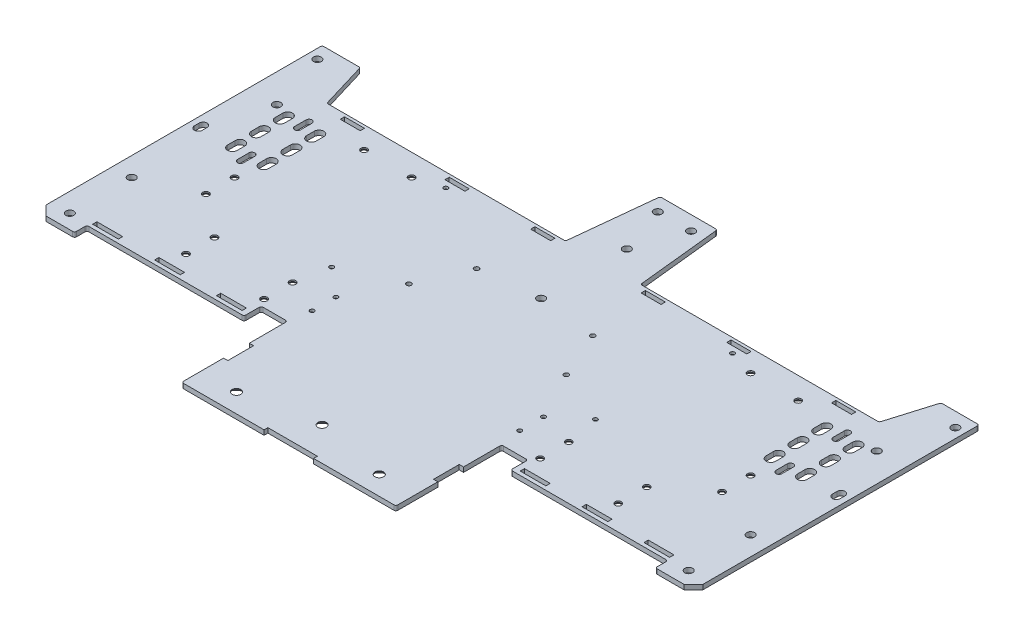
from build123d import *

# Parameters (mm, degrees)
EXTRUDE_1_DEPTH              = 5
EXTRUDE_2_DEPTH              = 5
SKETCH_22_W                  = 40
SKETCH_22_H                  = 13
EXTRUDE_3_DEPTH              = 5
CUT_EXTRUDE_1_DEPTH          = 45
CUT_EXTRUDE_4_DEPTH          = 70
SKETCH_23_W                  = 27.5
SKETCH_23_H                  = 18
CUT_EXTRUDE_6_DEPTH          = 10
SKETCH_27_W                  = 21
SKETCH_27_H                  = 4.5
CUT_EXTRUDE_7_DEPTH          = 478.441095843
SKETCH_38_W                  = 27
SKETCH_38_H                  = 4.5
SKETCH_38_W_2                = 4.5
SKETCH_38_H_2                = 27
SKETCH_38_W_3                = 52
SKETCH_38_H_3                = 4
CUT_EXTRUDE_8_DEPTH          = 478.441095843
HOLE_WIZARD_M61_AT_2_COUNT   = 2
HOLE_WIZARD_M61_AT_2_PITCH   = 50
HOLE_WIZARD_M61_AT_3_COUNT   = 2
HOLE_WIZARD_M61_AT_3_PITCH   = 406
HOLE_WIZARD_M61_AT_4_COUNT   = 2
HOLE_WIZARD_M61_AT_4_PITCH   = 456
HOLE_WIZARD_M41_D            = 4.5
HOLE_WIZARD_M41_CSINK_D      = 9.18
HOLE_WIZARD_M41_CSINK_ANGLE  = 90
HOLE_WIZARD_M82_D            = 8.25
HOLE_WIZARD_M82_2_AT_2_COUNT = 2
HOLE_WIZARD_M82_2_AT_2_PITCH = 150
HOLE_WIZARD_M82_2_AT_3_COUNT = 2
HOLE_WIZARD_M82_2_AT_3_PITCH = 76.485292704
HOLE_WIZARD_M62_D            = 6.6
HOLE_WIZARD_M62_DEPTH        = 17
HOLE_WIZARD_M62_CSINK_D      = 13.71
HOLE_WIZARD_M62_CSINK_ANGLE  = 90
HOLE_WIZARD_M62_TIP          = 1.982840043
HOLE_WIZARD_M42_D            = 4.5
HOLE_WIZARD_M42_CSINK_D      = 9.18
HOLE_WIZARD_M42_CSINK_ANGLE  = 90
CUT_EXTRUDE_10_DEPTH         = 478.441095843
CHAMFER_1_SIZE               = 10
FILLET_1_R                   = 2
SKETCH_46_R                  = 2.5
CUT_EXTRUDE_11_DEPTH         = 478.441095843


with BuildPart() as part:
    # Эскиз2 → Бобышка-Вытянуть1 (new body)
    with BuildSketch(Plane(origin=(0, 0, 0), x_dir=(1, 0, 0), z_dir=(0, 1, 0))):
        Polygon((112.5, -237), (112.5, -330), (-112.5, -330), (-112.5, -237), (-345, -237), (-345, 50), (-305, 50), (-290, 0), (290, 0), (305, 50), (345, 50), (345, -237), align=None)
    extrude(amount=EXTRUDE_1_DEPTH)

    # Эскиз21 → Бобышка-Вытянуть2 (add)
    with BuildSketch(Plane(origin=(0, 5, 0), x_dir=(1, 0, 0), z_dir=(0, 1, 0))):
        Polygon((-39.459381174, 0), (-30, 90), (30, 90), (39.459381174, 0), align=None)
    extrude(amount=-EXTRUDE_2_DEPTH)

    # Эскиз22 → Бобышка-Вытянуть3 (add)
    with BuildSketch(Plane(origin=(0, 5, 0), x_dir=(1, 0, 0), z_dir=(0, 1, 0))):
        with Locations((-325, -243.5)):
            Rectangle(SKETCH_22_W, SKETCH_22_H)
        with Locations((325, -243.5)):
            Rectangle(SKETCH_22_W, SKETCH_22_H)
    extrude(amount=-EXTRUDE_3_DEPTH)

    # Эскиз8 → Вырез-Вытянуть1 (cut)
    with BuildSketch(Plane(origin=(0, 5, 0), x_dir=(1, 0, 0), z_dir=(0, 1, 0))):
        with BuildLine():
            Line((-271.25, -40), (-271.25, -32))
            ThreePointArc((-271.25, -32), (-266.25, -27), (-261.25, -32))
            Line((-261.25, -32), (-261.25, -40))
            ThreePointArc((-261.25, -40), (-266.25, -45), (-271.25, -40))
        make_face()
        with BuildLine():
            Line((-271.25, -65), (-271.25, -57))
            ThreePointArc((-271.25, -57), (-266.25, -52), (-261.25, -57))
            Line((-261.25, -57), (-261.25, -65))
            ThreePointArc((-261.25, -65), (-266.25, -70), (-271.25, -65))
        make_face()
        with BuildLine():
            Line((-271.25, -90), (-271.25, -82))
            ThreePointArc((-271.25, -82), (-266.25, -77), (-261.25, -82))
            Line((-261.25, -82), (-261.25, -90))
            ThreePointArc((-261.25, -90), (-266.25, -95), (-271.25, -90))
        make_face()
        with BuildLine():
            Line((-304.25, -65), (-304.25, -57))
            ThreePointArc((-304.25, -57), (-299.25, -52), (-294.25, -57))
            Line((-294.25, -57), (-294.25, -65))
            ThreePointArc((-294.25, -65), (-299.25, -70), (-304.25, -65))
        make_face()
        with BuildLine():
            Line((-304.25, -40), (-304.25, -32))
            ThreePointArc((-304.25, -32), (-299.25, -27), (-294.25, -32))
            Line((-294.25, -32), (-294.25, -40))
            ThreePointArc((-294.25, -40), (-299.25, -45), (-304.25, -40))
        make_face()
        with BuildLine():
            Line((-304.25, -90), (-304.25, -82))
            ThreePointArc((-304.25, -82), (-299.25, -77), (-294.25, -82))
            Line((-294.25, -82), (-294.25, -90))
            ThreePointArc((-294.25, -90), (-299.25, -95), (-304.25, -90))
        make_face()
        with BuildLine():
            Line((271.25, -40), (271.25, -32))
            ThreePointArc((271.25, -32), (266.25, -27), (261.25, -32))
            Line((261.25, -32), (261.25, -40))
            ThreePointArc((261.25, -40), (266.25, -45), (271.25, -40))
        make_face()
        with BuildLine():
            Line((271.25, -65), (271.25, -57))
            ThreePointArc((271.25, -57), (266.25, -52), (261.25, -57))
            Line((261.25, -57), (261.25, -65))
            ThreePointArc((261.25, -65), (266.25, -70), (271.25, -65))
        make_face()
        with BuildLine():
            Line((271.25, -90), (271.25, -82))
            ThreePointArc((271.25, -82), (266.25, -77), (261.25, -82))
            Line((261.25, -82), (261.25, -90))
            ThreePointArc((261.25, -90), (266.25, -95), (271.25, -90))
        make_face()
        with BuildLine():
            Line((304.25, -65), (304.25, -57))
            ThreePointArc((304.25, -57), (299.25, -52), (294.25, -57))
            Line((294.25, -57), (294.25, -65))
            ThreePointArc((294.25, -65), (299.25, -70), (304.25, -65))
        make_face()
        with BuildLine():
            Line((304.25, -40), (304.25, -32))
            ThreePointArc((304.25, -32), (299.25, -27), (294.25, -32))
            Line((294.25, -32), (294.25, -40))
            ThreePointArc((294.25, -40), (299.25, -45), (304.25, -40))
        make_face()
        with BuildLine():
            Line((304.25, -90), (304.25, -82))
            ThreePointArc((304.25, -82), (299.25, -77), (294.25, -82))
            Line((294.25, -82), (294.25, -90))
            ThreePointArc((294.25, -90), (299.25, -95), (304.25, -90))
        make_face()
    extrude(amount=-CUT_EXTRUDE_1_DEPTH, mode=Mode.SUBTRACT)

    # Эскиз11 → Вырез-Вытянуть4 (cut)
    with BuildSketch(Plane(origin=(0, 5, 0), x_dir=(1, 0, 0), z_dir=(0, 1, 0))):
        with BuildLine():
            Line((-285.85, -38), (-285.85, -26))
            ThreePointArc((-285.85, -26), (-282.75, -22.9), (-279.65, -26))
            Line((-279.65, -26), (-279.65, -38))
            ThreePointArc((-279.65, -38), (-282.75, -41.1), (-285.85, -38))
        make_face()
        with BuildLine():
            Line((-285.85, -98), (-285.85, -86))
            ThreePointArc((-285.85, -86), (-282.75, -82.9), (-279.65, -86))
            Line((-279.65, -86), (-279.65, -98))
            ThreePointArc((-279.65, -98), (-282.75, -101.1), (-285.85, -98))
        make_face()
        with BuildLine():
            Line((285.85, -38), (285.85, -26))
            ThreePointArc((285.85, -26), (282.75, -22.9), (279.65, -26))
            Line((279.65, -26), (279.65, -38))
            ThreePointArc((279.65, -38), (282.75, -41.1), (285.85, -38))
        make_face()
        with BuildLine():
            Line((285.85, -98), (285.85, -86))
            ThreePointArc((285.85, -86), (282.75, -82.9), (279.65, -86))
            Line((279.65, -86), (279.65, -98))
            ThreePointArc((279.65, -98), (282.75, -101.1), (285.85, -98))
        make_face()
    extrude(amount=-CUT_EXTRUDE_4_DEPTH, mode=Mode.SUBTRACT)

    # Эскиз23 → Вырез-Вытянуть6 (cut)
    with BuildSketch(Plane(origin=(0, 5, 0), x_dir=(1, 0, 0), z_dir=(0, 1, 0))):
        with Locations((-126.25, -228)):
            Rectangle(SKETCH_23_W, SKETCH_23_H)
        with Locations((126.25, -228)):
            Rectangle(SKETCH_23_W, SKETCH_23_H)
    extrude(amount=-CUT_EXTRUDE_6_DEPTH, mode=Mode.SUBTRACT)

    # Эскиз27 → Вырез-Вытянуть7 (cut, through all)
    with BuildSketch(Plane(origin=(0, 5, 0), x_dir=(1, 0, 0), z_dir=(0, 1, 0))):
        with Locations((-258, -5.25)):
            Rectangle(SKETCH_27_W, SKETCH_27_H)
        with Locations((-148, -5.25)):
            Rectangle(SKETCH_27_W, SKETCH_27_H)
        with Locations((-58, -5.25)):
            Rectangle(SKETCH_27_W, SKETCH_27_H)
        with Locations((58, -5.25)):
            Rectangle(SKETCH_27_W, SKETCH_27_H)
        with Locations((148, -5.25)):
            Rectangle(SKETCH_27_W, SKETCH_27_H)
        with Locations((258, -5.25)):
            Rectangle(SKETCH_27_W, SKETCH_27_H)
    extrude(amount=-CUT_EXTRUDE_7_DEPTH, mode=Mode.SUBTRACT)

    # Эскиз38 → Вырез-Вытянуть8 (cut, through all)
    with BuildSketch(Plane(origin=(0, 5, 0), x_dir=(1, 0, 0), z_dir=(0, 1, 0))):
        with Locations((-159.5, -230.75)):
            Rectangle(SKETCH_38_W, SKETCH_38_H)
        with Locations((-224.5, -230.75)):
            Rectangle(SKETCH_38_W, SKETCH_38_H)
        with Locations((-289.5, -230.75)):
            Rectangle(SKETCH_38_W, SKETCH_38_H)
        with Locations((289.5, -230.75)):
            Rectangle(SKETCH_38_W, SKETCH_38_H)
        with Locations((224.5, -230.75)):
            Rectangle(SKETCH_38_W, SKETCH_38_H)
        with Locations((159.5, -230.75)):
            Rectangle(SKETCH_38_W, SKETCH_38_H)
        with Locations((-110.25, -272.5)):
            Rectangle(SKETCH_38_W_2, SKETCH_38_H_2)
        with Locations((110.25, -272.5)):
            Rectangle(SKETCH_38_W_2, SKETCH_38_H_2)
        with Locations((0, -328)):
            Rectangle(SKETCH_38_W_3, SKETCH_38_H_3)
    extrude(amount=-CUT_EXTRUDE_8_DEPTH, mode=Mode.SUBTRACT)

    # Эскиз25 → Зенковка для винта с потайной головкой и внутренним шестигранником M61 (revolve, cut)
    with BuildSketch(Plane(origin=(-228, 0, 23), x_dir=(0, 0, -1), z_dir=(1, 0, 0))):
        Polygon((0, 0), (0, 5), (3.3, 5), (3.3, 3.555), (6.855, 0), align=None)
    hole_wizard_m61 = revolve(axis=Axis((-228, -6.35, 23), (0, 1, 0)), mode=Mode.SUBTRACT)

    # Зенковка для винта с потайной головкой и внутренним шестигранником M61 at 2: Зенковка для винта с потайной головкой и внутренним шестигранником M61 ×2
    with Locations(*[(i * HOLE_WIZARD_M61_AT_2_PITCH, 0, 0) for i in range(1, HOLE_WIZARD_M61_AT_2_COUNT)]):
        add(hole_wizard_m61, mode=Mode.SUBTRACT)

    # Зенковка для винта с потайной головкой и внутренним шестигранником M61 at 3: Зенковка для винта с потайной головкой и внутренним шестигранником M61 ×2
    with Locations(*[(i * HOLE_WIZARD_M61_AT_3_PITCH, 0, 0) for i in range(1, HOLE_WIZARD_M61_AT_3_COUNT)]):
        add(hole_wizard_m61, mode=Mode.SUBTRACT)

    # Зенковка для винта с потайной головкой и внутренним шестигранником M61 at 4: Зенковка для винта с потайной головкой и внутренним шестигранником M61 ×2
    with Locations(*[(i * HOLE_WIZARD_M61_AT_4_PITCH, 0, 0) for i in range(1, HOLE_WIZARD_M61_AT_4_COUNT)]):
        add(hole_wizard_m61, mode=Mode.SUBTRACT)

    # Зенковка для винта с потайной головкой и внутренним шестигранником M41 (through all)
    with Locations(Plane.XZ):
        with Locations((-150.5, 14.5), (150.5, 14.5), (-138.5, 146.5), (138.5, 146.5)):
            CounterSinkHole(HOLE_WIZARD_M41_D / 2, HOLE_WIZARD_M41_CSINK_D / 2, counter_sink_angle=HOLE_WIZARD_M41_CSINK_ANGLE)

    # Hole Wizard M82 (through all)
    with Locations(Plane.XZ):
        with Locations((-335, -35), (-315, 27.5), (-335, 85), (-325, 235), (325, 235), (335, 85), (315, 27.5), (335, -35), (-17.5, -75), (0, -25), (0, 65), (17.5, -75), (-325, 170), (325, 170)):
            Hole(HOLE_WIZARD_M82_D / 2)

    # Эскиз35 → Hole Wizard M82 2 (revolve, cut)
    with BuildSketch(Plane(origin=(75, 0, 310), x_dir=(0, 0, -1), z_dir=(1, 0, 0))):
        Polygon((0, 0), (0, 5), (4.5, 5), (4.5, 4.625), (9.125, 0), align=None)
    hole_wizard_m82_2 = revolve(axis=Axis((75, -6.35, 310), (0, 1, 0)), mode=Mode.SUBTRACT)

    # Hole Wizard M82 2 at 2: Hole Wizard M82 2 ×2
    with Locations(*[(-i * HOLE_WIZARD_M82_2_AT_2_PITCH, 0, 0) for i in range(1, HOLE_WIZARD_M82_2_AT_2_COUNT)]):
        add(hole_wizard_m82_2, mode=Mode.SUBTRACT)

    # Hole Wizard M82 2 at 3: Hole Wizard M82 2 ×2
    with Locations(*[Vector(-0.9805806756909202, 0, -0.19611613513818407) * (i * HOLE_WIZARD_M82_2_AT_3_PITCH) for i in range(1, HOLE_WIZARD_M82_2_AT_3_COUNT)]):
        add(hole_wizard_m82_2, mode=Mode.SUBTRACT)

    # Зенковка для винта с потайной головкой и внутренним шестигранником M62
    with Locations(Plane(origin=(0, 0, 0), x_dir=(-1, 0, 0), z_dir=(0, -1, 0))):
        with Locations((-227, -211), (227, -211), (-227, -181), (227, -181), (-271, -146), (-271, -116), (271, -116), (271, -146), (-145, -181), (-145, -211), (145, -211), (145, -181)):
            CounterSinkHole(HOLE_WIZARD_M62_D / 2, HOLE_WIZARD_M62_CSINK_D / 2, depth=HOLE_WIZARD_M62_DEPTH, counter_sink_angle=HOLE_WIZARD_M62_CSINK_ANGLE)
            with Locations((0, 0, -(HOLE_WIZARD_M62_DEPTH + HOLE_WIZARD_M62_TIP / 2))):  # 118° drill point
                Cone(0, HOLE_WIZARD_M62_D / 2, HOLE_WIZARD_M62_TIP, mode=Mode.SUBTRACT)

    # Зенковка для винта с потайной головкой и внутренним шестигранником M42 (through all)
    with Locations(Plane(origin=(0, 0, 0), x_dir=(-1, 0, 0), z_dir=(0, -1, 0))):
        with Locations((-109, -171.5), (-109, -196.5), (109, -196.5), (109, -171.5)):
            CounterSinkHole(HOLE_WIZARD_M42_D / 2, HOLE_WIZARD_M42_CSINK_D / 2, counter_sink_angle=HOLE_WIZARD_M42_CSINK_ANGLE)

    # Эскиз45 → Вырез-Вытянуть10 (cut, through all)
    with BuildSketch(Plane.XZ):
        with BuildLine():
            Line((-339.125, 90), (-339.125, 85))
            Line((-339.125, 85), (-330.875, 85))
            Line((-330.875, 85), (-330.875, 90))
            ThreePointArc((-330.875, 90), (-335, 94.125), (-339.125, 90))
        make_face()
        with BuildLine():
            Line((330.875, 90), (330.875, 85))
            Line((330.875, 85), (339.125, 85))
            Line((339.125, 85), (339.125, 90))
            ThreePointArc((339.125, 90), (335, 94.125), (330.875, 90))
        make_face()
    extrude(amount=-CUT_EXTRUDE_10_DEPTH, mode=Mode.SUBTRACT)

    # Фаска1
    chamfer_1_edges = [part.edges().sort_by_distance(p)[0] for p in [
        (-345, 2.5, 250),
        (345, 2.5, 250),
    ]]
    chamfer(chamfer_1_edges, length=CHAMFER_1_SIZE)

    # Скругление1
    fillet_1_edges = [part.edges().sort_by_distance(p)[0] for p in [
        (-305, 2.5, -50),
        (-290, 2.5, 0),
        (290, 2.5, 0),
        (305, 2.5, -50),
        (345, 2.5, -50),
        (112.5, 2.5, 330),
        (-112.5, 2.5, 330),
        (-345, 2.5, -50),
        (39.459381174, 2.5, 0),
        (-39.459381174, 2.5, 0),
        (-30, 2.5, -90),
        (30, 2.5, -90),
        (-140, 2.5, 237),
        (-140, 2.5, 219),
        (-112.5, 2.5, 219),
        (140, 2.5, 219),
        (140, 2.5, 237),
        (112.5, 2.5, 219),
        (-305, 2.5, 237),
        (-305, 2.5, 250),
        (305, 2.5, 237),
        (305, 2.5, 250),
    ]]
    fillet(fillet_1_edges, radius=FILLET_1_R)

    # Эскиз46 → Вырез-Вытянуть11 (cut, through all)
    with BuildSketch(Plane(origin=(0, 5, 0), x_dir=(1, 0, 0), z_dir=(0, 1, 0))):
        with Locations(Location((82.669967975, -121.2, 0), (0, 0, 270))):
            Circle(SKETCH_46_R)
        with Locations(Location((60.99052879, -71.782151237, 0), (0, 0, 270))):
            Circle(SKETCH_46_R)
        with Locations(Location((-60.99052879, -71.782151237, 0), (0, 0, 90))):
            Circle(SKETCH_46_R)
        with Locations(Location((-82.669967975, -121.2, 0), (0, 0, 90))):
            Circle(SKETCH_46_R)
    extrude(amount=-CUT_EXTRUDE_11_DEPTH, mode=Mode.SUBTRACT)


solid = part.part
